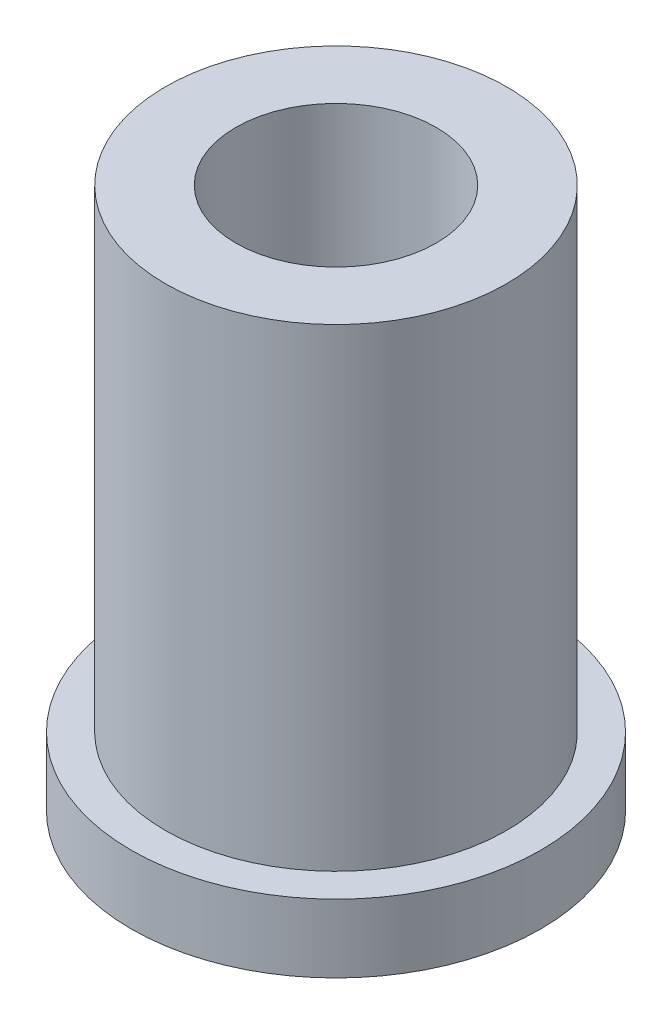
from build123d import *

# Parameters (mm, degrees)
SKETCH_1_R      = 4
SKETCH_1_R_2    = 2.35
EXTRUDE_1_DEPTH = 12.7
SKETCH_1_3_R    = 4.8
SKETCH_1_3_R_2  = 4
EXTRUDE_2_DEPTH = 1.6


with BuildPart() as part:
    # 스케치1 → 보스-돌출1 (new body)
    with BuildSketch(Plane(origin=(0, 0, 0), x_dir=(1, 0, 0), z_dir=(0, 1, 0))):
        Circle(SKETCH_1_R)
        Circle(SKETCH_1_R_2, mode=Mode.SUBTRACT)
    extrude(amount=EXTRUDE_1_DEPTH)

    # 스케치1<3> → 보스-돌출2 (add)
    with BuildSketch(Plane(origin=(0, 0, 0), x_dir=(1, 0, 0), z_dir=(0, 1, 0))):
        Circle(SKETCH_1_3_R)
        Circle(SKETCH_1_3_R_2, mode=Mode.SUBTRACT)
    extrude(amount=EXTRUDE_2_DEPTH)


solid = part.part
